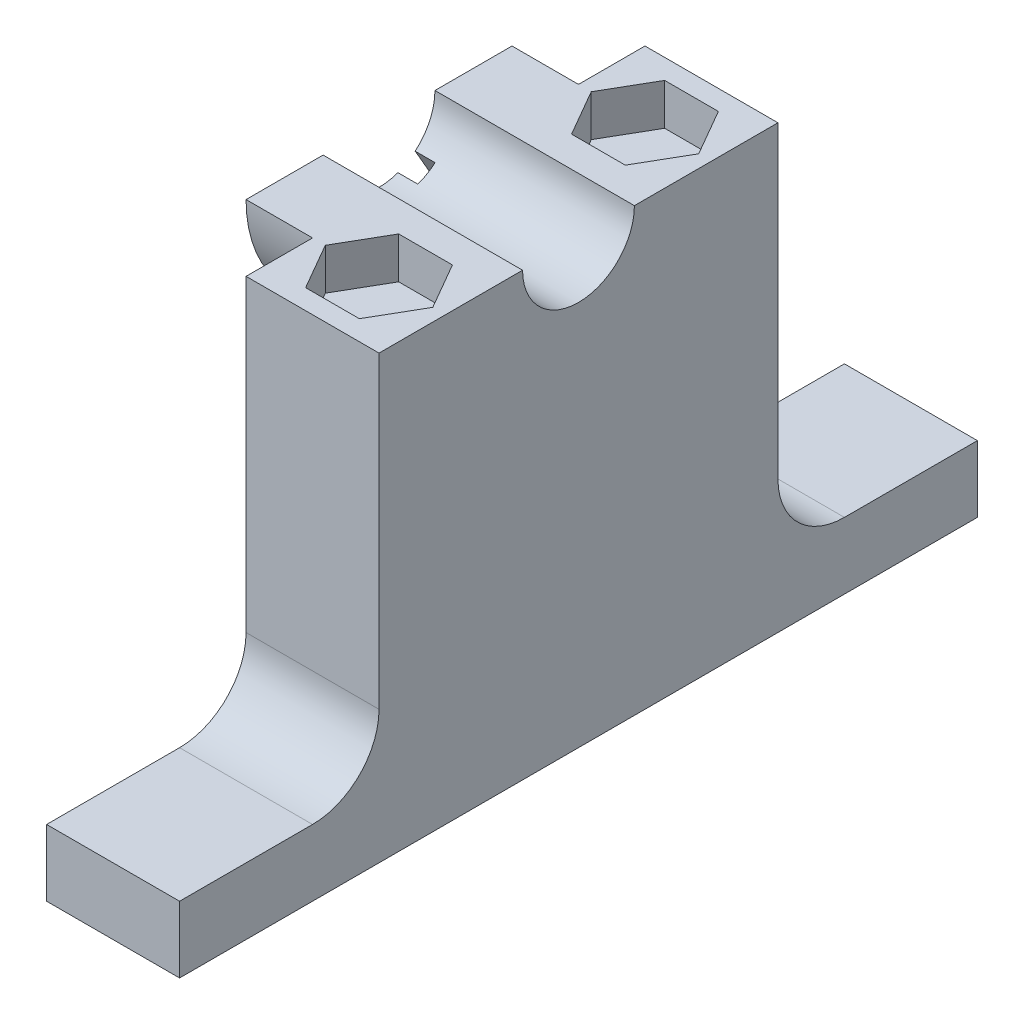
from build123d import *

# Parameters (mm, degrees)
SKETCH1_W                    = 10
SKETCH1_H                    = 30
BOSS_EXTRUDE1_DEPTH          = 33.2
SKETCH2_R                    = 4.205
CUT_EXTRUDE1_DEPTH           = 38.778830051
CUT_EXTRUDE2_DEPTH           = 3.12
SKETCH4_W                    = 60
SKETCH4_H                    = 5
BOSS_EXTRUDE2_DEPTH          = 10
FILLET1_R                    = 5
BOSS_EXTRUDE3_START          = 5
BOSS_EXTRUDE3_DEPTH          = 5
CUT_EXTRUDE_THIN1_DEPTH      = 48.19364364
CUT_EXTRUDE_THIN1_DEPTH_BACK = 1.5
CUT_EXTRUDE_THIN2_DEPTH      = 48.19364364
CUT_EXTRUDE_THIN2_DEPTH_BACK = 1.5


with BuildPart() as part:
    # Sketch1 → Boss-Extrude1 (new body)
    with BuildSketch(Plane(origin=(0, 0, 0), x_dir=(1, 0, 0), z_dir=(0, 1, 0))):
        Rectangle(SKETCH1_W, SKETCH1_H)
    extrude(amount=BOSS_EXTRUDE1_DEPTH)

    # Sketch2 → Cut-Extrude1 (cut, through all)
    with BuildSketch(Plane.ZY.offset(5)):
        with Locations((0, 33.2)):
            Circle(SKETCH2_R)
    extrude(amount=-CUT_EXTRUDE1_DEPTH, mode=Mode.SUBTRACT)

    # Sketch3 → Cut-Extrude2 (cut)
    with BuildSketch(Plane(origin=(0, 33.2, 0), x_dir=(1, 0, 0), z_dir=(0, 1, 0))):
        Polygon((2.020725942, 6.5), (4.041451884, 10), (2.020725942, 13.5), (-2.020725942, 13.5), (-4.041451884, 10), (-2.020725942, 6.5), align=None)
    cut_extrude2 = extrude(amount=-CUT_EXTRUDE2_DEPTH, mode=Mode.SUBTRACT)

    # Mirror1: Cut-Extrude2 across plane
    add(cut_extrude2.mirror(Plane.XY), mode=Mode.SUBTRACT)

    # Sketch4 → Boss-Extrude2 (add)
    with BuildSketch(Plane(origin=(5, 0, 0), x_dir=(0, 0, -1), z_dir=(1, 0, 0))):
        with Locations((0, 2.5)):
            Rectangle(SKETCH4_W, SKETCH4_H)
    extrude(amount=-BOSS_EXTRUDE2_DEPTH)

    # Fillet1
    fillet1_edges = [part.edges().sort_by_distance(p)[0] for p in [
        (0, 5, -15),
        (0, 5, 15),
    ]]
    fillet(fillet1_edges, radius=FILLET1_R)

    # Sketch5 → Boss-Extrude3 (add)
    with BuildSketch(Plane.ZY.offset(5).offset(BOSS_EXTRUDE3_START)):
        with BuildLine():
            Line((-10, 33.2), (-4.205, 33.2))
            ThreePointArc((-4.205, 33.2), (0, 28.995), (4.205, 33.2))
            Line((4.205, 33.2), (10, 33.2))
            ThreePointArc((10, 33.2), (0, 23.2), (-10, 33.2))
        make_face()
    extrude(amount=-BOSS_EXTRUDE3_DEPTH)

    # Sketch6 → Cut-Extrude-Thin1 (cut, two sides: drawn at the far end of the back side and taken through both)
    with BuildSketch(Plane.ZY.offset(10).offset(-CUT_EXTRUDE_THIN1_DEPTH_BACK)):
        Polygon((-0.649519053, 32.825), (4.350480947, 24.164745962), (5.649519053, 24.914745962), (0.649519053, 33.575), align=None)
    extrude(amount=CUT_EXTRUDE_THIN1_DEPTH + CUT_EXTRUDE_THIN1_DEPTH_BACK, mode=Mode.SUBTRACT)

    # Sketch7 → Cut-Extrude-Thin2 (cut, two sides: drawn at the far end of the back side and taken through both)
    with BuildSketch(Plane.ZY.offset(10).offset(-CUT_EXTRUDE_THIN2_DEPTH_BACK)):
        Polygon((-0.649519053, 33.575), (-5.649519053, 24.914745962), (-4.350480947, 24.164745962), (0.649519053, 32.825), align=None)
    extrude(amount=CUT_EXTRUDE_THIN2_DEPTH + CUT_EXTRUDE_THIN2_DEPTH_BACK, mode=Mode.SUBTRACT)


solid = part.part
